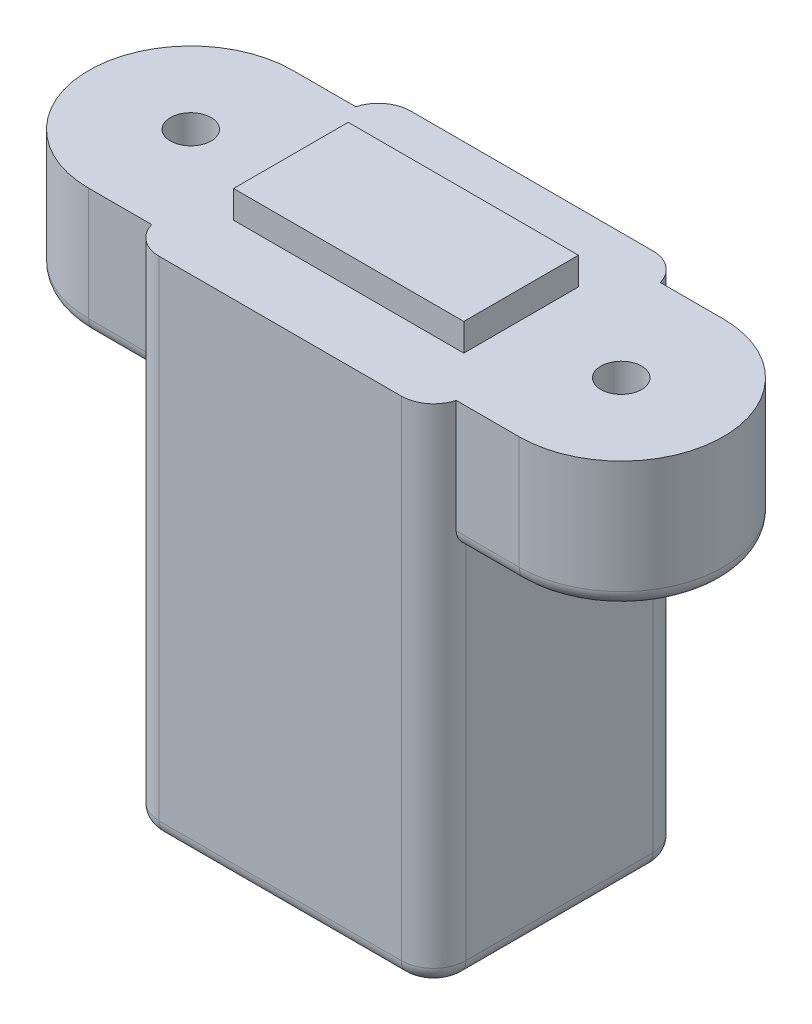
from build123d import *

# Parameters (mm, degrees)
BOSS_EXTRUDE1_DEPTH   = 5.08
M2X0_4_TAPPED_HOLE1_D = 1.6
SKETCH8_W             = 12.065
SKETCH8_H             = 9.8933
BOSS_EXTRUDE2_DEPTH   = 19.8628
FILLET1_R             = 1.27
FILLET2_R             = 0.635
FILLET3_R             = 0.635
SKETCH9_W             = 9.0551
SKETCH9_H             = 4.5085
BOSS_EXTRUDE3_DEPTH   = 1.0795


with BuildPart() as part:
    # Sketch1 → Boss-Extrude1 (new body)
    with BuildSketch(Plane(origin=(0, 0, 0), x_dir=(1, 0, 0), z_dir=(0, 1, 0))):
        with BuildLine():
            Line((8.46455, -4.0132), (-8.46455, -4.0132))
            ThreePointArc((-8.46455, -4.0132), (-12.47775, 0), (-8.46455, 4.0132))
            Line((-8.46455, 4.0132), (8.46455, 4.0132))
            ThreePointArc((8.46455, 4.0132), (12.47775, 0), (8.46455, -4.0132))
        make_face()
    extrude(amount=BOSS_EXTRUDE1_DEPTH)

    # M2x0.4 Tapped Hole1 (through all)
    with Locations(Plane(origin=(0, 5.08, 0), x_dir=(1, 0, 0), z_dir=(0, 1, 0))):
        with Locations((-8.46455, 0), (8.46455, 0)):
            Hole(M2X0_4_TAPPED_HOLE1_D / 2)

    # Sketch8 → Boss-Extrude2 (add)
    with BuildSketch(Plane(origin=(0, 5.08, 0), x_dir=(1, 0, 0), z_dir=(0, 1, 0))):
        Rectangle(SKETCH8_W, SKETCH8_H)
    extrude(amount=-BOSS_EXTRUDE2_DEPTH)

    # Fillet1
    fillet1_edges = [part.edges().sort_by_distance(p)[0] for p in [
        (-6.0325, -4.8514, 4.94665),
        (6.0325, -4.8514, 4.94665),
        (-6.0325, -4.8514, -4.94665),
        (6.0325, -4.8514, -4.94665),
    ]]
    fillet(fillet1_edges, radius=FILLET1_R)

    # Fillet2
    fillet2_edges = [part.edges().sort_by_distance(p)[0] for p in [
        (-7.225822742, 0, 4.0132),
        (-12.47775, 0, 0),
        (-7.225822742, 0, -4.0132),
        (7.225822742, 0, -4.0132),
        (7.225822742, 0, 4.0132),
        (12.47775, 0, 0),
    ]]
    fillet(fillet2_edges, radius=FILLET2_R)

    # Fillet3
    fillet3_edges = [part.edges().sort_by_distance(p)[0] for p in [
        (5.660525612, -14.7828, 4.574675612),
        (6.0325, -14.7828, 0),
        (5.660525612, -14.7828, -4.574675612),
        (0, -14.7828, -4.94665),
        (-5.660525612, -14.7828, -4.574675612),
        (-6.0325, -14.7828, 0),
        (-5.660525612, -14.7828, 4.574675612),
        (0, -14.7828, 4.94665),
    ]]
    fillet(fillet3_edges, radius=FILLET3_R)

    # Sketch9 → Boss-Extrude3 (add)
    with BuildSketch(Plane(origin=(0, 5.08, 0), x_dir=(1, 0, 0), z_dir=(0, 1, 0))):
        Rectangle(SKETCH9_W, SKETCH9_H)
    extrude(amount=BOSS_EXTRUDE3_DEPTH)


solid = part.part
